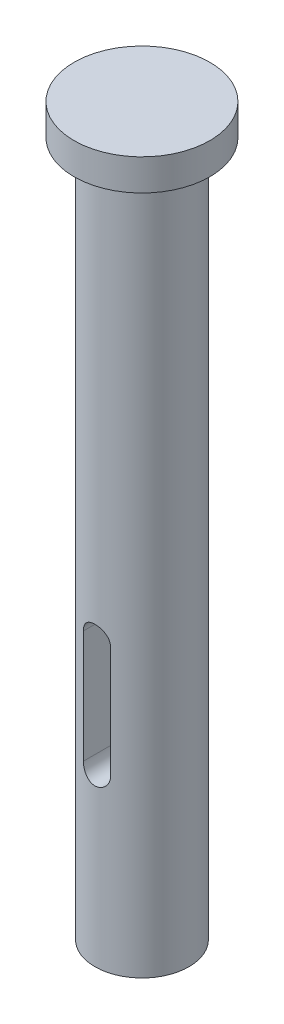
from build123d import *

# Parameters (mm, degrees)
SKETCH1_R           = 11.43
BOSS_EXTRUDE1_DEPTH = 176.53
CUT_EXTRUDE1_DEPTH  = 73.66
BOSS_EXTRUDE2_START = -7.62
SKETCH3_R           = 16.51
SKETCH3_R_2         = 11.43
BOSS_EXTRUDE2_DEPTH = 7.62


with BuildPart() as part:
    # Sketch1 → Boss-Extrude1 (new body)
    with BuildSketch(Plane(origin=(0, 0, 0), x_dir=(1, 0, 0), z_dir=(0, 1, 0))):
        with Locations(Location((0, 0, 0), (0, 0, 270))):
            Circle(SKETCH1_R)
    extrude(amount=BOSS_EXTRUDE1_DEPTH)

    # Sketch2 → Cut-Extrude1 (cut)
    with BuildSketch(Plane.XY.offset(11.43)):
        with BuildLine():
            Line((3.301999683, 41.402000653), (3.301999683, 68.83399967))
            ThreePointArc((3.301999683, 68.83399967), (0, 72.136), (-3.302000317, 68.834000304))
            Line((-3.302000317, 68.834000304), (-3.302000317, 41.402000019))
            ThreePointArc((-3.302000317, 41.402000019), (0, 38.1), (3.301999683, 41.402000653))
        make_face()
    extrude(amount=-CUT_EXTRUDE1_DEPTH, mode=Mode.SUBTRACT)

    # Sketch3 → Boss-Extrude2 (add)
    with BuildSketch(Plane(origin=(0, 176.53, 0), x_dir=(1, 0, 0), z_dir=(0, 1, 0)).offset(BOSS_EXTRUDE2_START)):
        with Locations(Location((0, 0, 0), (0, 0, 270))):
            Circle(SKETCH3_R)
        with Locations(Location((0, 0, 0), (0, 0, 270))):
            Circle(SKETCH3_R_2, mode=Mode.SUBTRACT)
    extrude(amount=BOSS_EXTRUDE2_DEPTH)


solid = part.part
